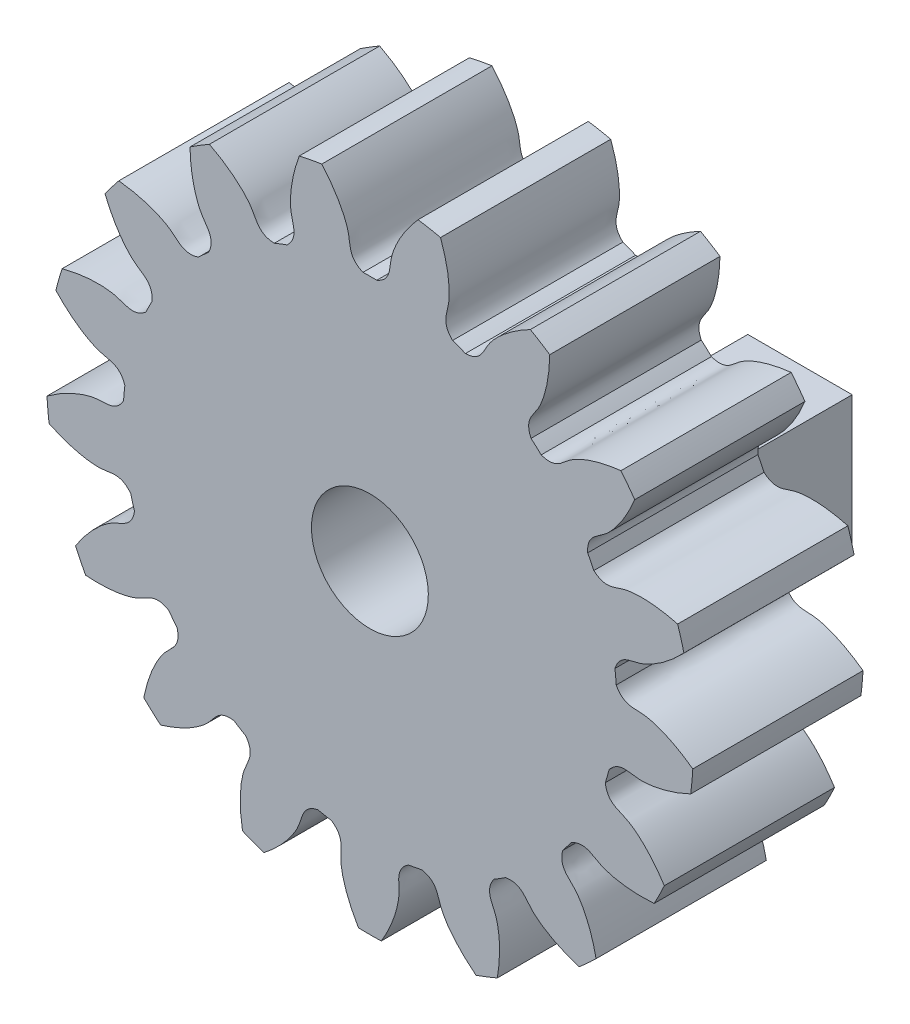
from build123d import *

# Parameters (mm, degrees)
SKETCH_1_R               = 28.5
EXTRUDE_1_DEPTH          = 15
CUT_EXTRUDE_1_DEPTH      = 44.00581356
PATTERN_CIRCULAR_1_COUNT = 17
EXTRUDE_2_DEPTH          = 15
SKETCH_5_R               = 1.15
SKETCH_5_R_2             = 1.65
CUT_EXTRUDE_2_DEPTH      = 46.693084086
SKETCH_6_R               = 5.15
CUT_EXTRUDE_3_DEPTH      = 51.218116529


with BuildPart() as part:
    # 草图1 → 凸台-拉伸1 (new body)
    with BuildSketch(Plane.XY):
        Circle(SKETCH_1_R)
    extrude(amount=EXTRUDE_1_DEPTH)

    # 草图2 → 切除-拉伸1 (cut, through all)
    with BuildSketch(Plane.XY):
        with BuildLine():
            ThreePointArc((0.605081241, 21.741581743), (0, 21.75), (-0.605081241, 21.741581743))
            add(Edge.make_bspline(
                [(-0.605081241, 21.741581743), (-1.883639221, 22.274466064), (-1.698586134, 23.26444022), (-1.914916814, 24.194472413), (-1.934927203, 24.273451785), (-1.959055508, 24.361257941), (-1.98765177, 24.457755998), (-2.021075333, 24.562798091), (-2.059677239, 24.676226272), (-2.103805336, 24.797871753), (-2.153802336, 24.927555282), (-2.210006036, 25.065087193), (-2.272748892, 25.210267559), (-2.342357782, 25.362886323), (-2.419153727, 25.522723443), (-2.503451625, 25.689549046), (-2.595559985, 25.863123583), (-2.695780667, 26.043197999), (-2.804408627, 26.2295139), (-2.921731664, 26.421803731), (-3.048030173, 26.619790963), (-3.1835769, 26.823190282), (-3.328636707, 27.031707786), (-3.483466335, 27.245041186), (-3.648314178, 27.462880017), (-3.823420057, 27.684905848), (-4.009015004, 27.910792508), (-4.20532105, 28.140206308), (-4.412551012, 28.372806269), (-4.630908298, 28.608244364), (-4.86058671, 28.846165754), (-5.101770249, 29.086209039), (-5.354632937, 29.328006505), (-5.619338636, 29.571184379), (-5.896040878, 29.815363096), (-6.184882696, 30.060157557), (-6.485996473, 30.305177399), (-6.799503782, 30.550027271), (-7.125515246, 30.794307109), (-7.464130392, 31.037612419), (-7.815437541, 31.279534556), (-8.179513603, 31.519661024), (-8.687464904, 31.8402916), (-9.079730706, 32.071577913), (-9.346937499, 32.222157355)],
                knots=[0, 0, 0, 0, 0.193882922, 0.199023975, 0.204850501, 0.211362501, 0.218559975, 0.226442923, 0.235011345, 0.24426524, 0.254204608, 0.264829451, 0.276139767, 0.288135557, 0.300816821, 0.314183558, 0.328235769, 0.342973453, 0.358396612, 0.374505244, 0.39129935, 0.408778929, 0.426943982, 0.445794509, 0.46533051, 0.485551984, 0.506458932, 0.528051354, 0.550329249, 0.573292619, 0.596941461, 0.621275778, 0.646295568, 0.672000832, 0.69839157, 0.725467781, 0.753229466, 0.781676625, 0.810809257, 0.840627364, 0.871130943, 0.902319997, 0.934194524, 1, 1, 1, 1], degree=3))
            ThreePointArc((-9.346937499, 32.222157355), (0, 33.550449553), (9.346937499, 32.222157355))
            add(Edge.make_bspline(
                [(0.605081241, 21.741581743), (1.883639221, 22.274466064), (1.698586134, 23.26444022), (1.914916814, 24.194472413), (1.934927203, 24.273451785), (1.959055508, 24.361257941), (1.98765177, 24.457755998), (2.021075333, 24.562798091), (2.059677239, 24.676226272), (2.103805336, 24.797871753), (2.153802336, 24.927555282), (2.210006036, 25.065087193), (2.272748892, 25.210267559), (2.342357782, 25.362886323), (2.419153727, 25.522723443), (2.503451625, 25.689549046), (2.595559985, 25.863123583), (2.695780667, 26.043197999), (2.804408627, 26.2295139), (2.921731664, 26.421803731), (3.048030173, 26.619790963), (3.1835769, 26.823190282), (3.328636707, 27.031707786), (3.483466335, 27.245041186), (3.648314178, 27.462880017), (3.823420057, 27.684905848), (4.009015004, 27.910792508), (4.20532105, 28.140206308), (4.412551012, 28.372806269), (4.630908298, 28.608244364), (4.86058671, 28.846165754), (5.101770249, 29.086209039), (5.354632937, 29.328006505), (5.619338636, 29.571184379), (5.896040878, 29.815363096), (6.184882696, 30.060157557), (6.485996473, 30.305177399), (6.799503782, 30.550027271), (7.125515246, 30.794307109), (7.464130392, 31.037612419), (7.815437541, 31.279534556), (8.179513603, 31.519661024), (8.687464904, 31.8402916), (9.079730706, 32.071577913), (9.346937499, 32.222157355)],
                knots=[0, 0, 0, 0, 0.193882922, 0.199023975, 0.204850501, 0.211362501, 0.218559975, 0.226442923, 0.235011345, 0.24426524, 0.254204608, 0.264829451, 0.276139767, 0.288135557, 0.300816821, 0.314183558, 0.328235769, 0.342973453, 0.358396612, 0.374505244, 0.39129935, 0.408778929, 0.426943982, 0.445794509, 0.46533051, 0.485551984, 0.506458932, 0.528051354, 0.550329249, 0.573292619, 0.596941461, 0.621275778, 0.646295568, 0.672000832, 0.69839157, 0.725467781, 0.753229466, 0.781676625, 0.810809257, 0.840627364, 0.871130943, 0.902319997, 0.934194524, 1, 1, 1, 1], degree=3))
        make_face()
    cut_extrude_1 = extrude(amount=CUT_EXTRUDE_1_DEPTH, mode=Mode.SUBTRACT)

    # 阵列(圆周)1: 切除-拉伸1 ×17 about axis
    pattern_circular_1_axis = Axis((0, 0, -0.75), (0, 0, 1))
    for i in range(1, PATTERN_CIRCULAR_1_COUNT):
        add(cut_extrude_1.rotate(pattern_circular_1_axis, i * 360 / PATTERN_CIRCULAR_1_COUNT), mode=Mode.SUBTRACT)

    # 草图4 → 凸台-拉伸2 (add)
    with BuildSketch(Plane(origin=(0, 0, 0), x_dir=(-1, 0, 0), z_dir=(0, 0, -1))):
        with BuildLine():
            Line((-3.3, 3.953795645), (-12.5, 3.953795645))
            Line((-12.5, 3.953795645), (-12.5, -8.046204355))
            Line((-12.5, -8.046204355), (12.5, -8.046204355))
            Line((12.5, -8.046204355), (12.5, 3.953795645))
            Line((12.5, 3.953795645), (3.3, 3.953795645))
            ThreePointArc((3.3, 3.953795645), (4.664627531, 2.182601659), (5.15, 0))
            ThreePointArc((5.15, 0), (-2.182601659, -4.664627531), (-3.3, 3.953795645))
        make_face()
    extrude(amount=EXTRUDE_2_DEPTH)

    # 草图5 → 切除-拉伸2 (cut, through all)
    with BuildSketch(Plane(origin=(0, 3.953795645, 0), x_dir=(1, 0, 0), z_dir=(0, 1, 0))):
        with Locations((8.5, 11)):
            Circle(SKETCH_5_R)
        with Locations((8.5, 4)):
            Circle(SKETCH_5_R)
        with Locations((0, 9)):
            Circle(SKETCH_5_R_2)
        with Locations((-8.5, 11)):
            Circle(SKETCH_5_R)
        with Locations((-8.5, 4)):
            Circle(SKETCH_5_R)
    extrude(amount=-CUT_EXTRUDE_2_DEPTH, mode=Mode.SUBTRACT)

    # 草图6 → 切除-拉伸3 (cut, through all)
    with BuildSketch(Plane(origin=(0, 0, -15), x_dir=(-1, 0, 0), z_dir=(0, 0, -1))):
        Circle(SKETCH_6_R)
    extrude(amount=-CUT_EXTRUDE_3_DEPTH, mode=Mode.SUBTRACT)


solid = part.part
